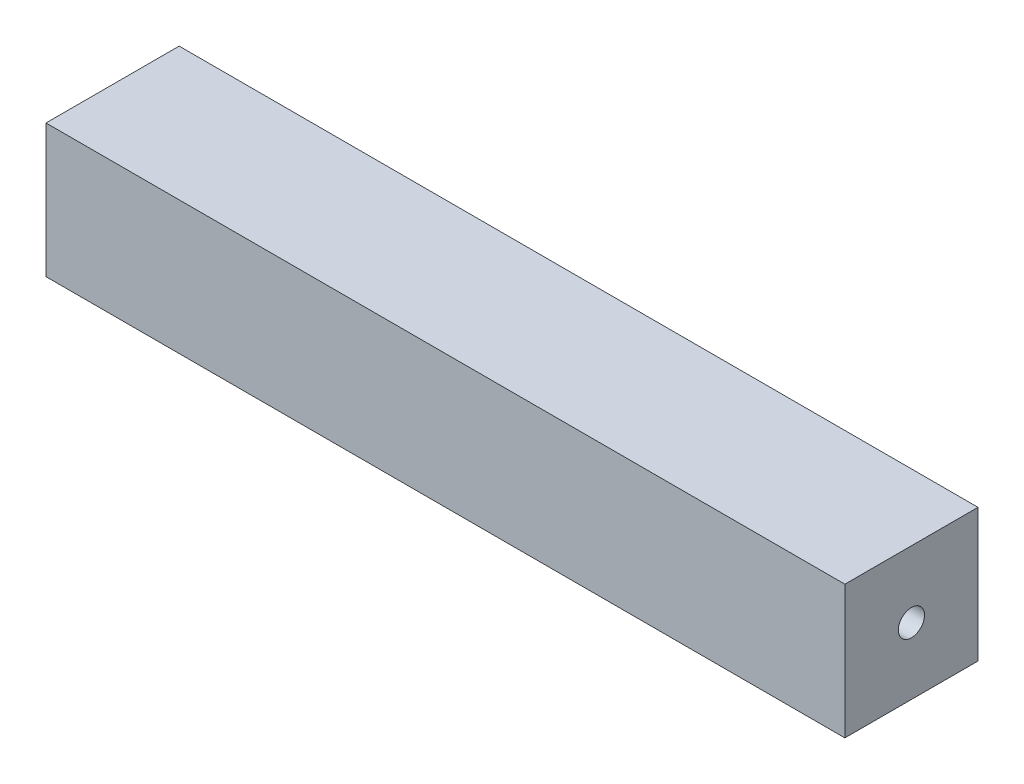
from build123d import *

# Parameters (mm, degrees)
SKETCH1_W           = 76.2
SKETCH1_H           = 12.7
BOSS_EXTRUDE1_DEPTH = 12.7
SKETCH3_R           = 1.25
CUT_EXTRUDE1_DEPTH  = 15.24
CUT_EXTRUDE2_START  = -15.24
SKETCH2_R           = 1.25
CUT_EXTRUDE2_DEPTH  = 15.24


with BuildPart() as part:
    # Sketch1 → Boss-Extrude1 (new body)
    with BuildSketch(Plane(origin=(0, 0, 0), x_dir=(1, 0, 0), z_dir=(0, 1, 0))):
        with Locations((38.1, 6.35)):
            Rectangle(SKETCH1_W, SKETCH1_H)
    extrude(amount=BOSS_EXTRUDE1_DEPTH)

    # Sketch3 → Cut-Extrude1 (cut)
    with BuildSketch(Plane.ZY):
        with Locations((-6.35, 6.35)):
            Circle(SKETCH3_R)
    extrude(amount=-CUT_EXTRUDE1_DEPTH, mode=Mode.SUBTRACT)

    # Sketch2 → Cut-Extrude2 (cut)
    with BuildSketch(Plane(origin=(76.2, 0, 0), x_dir=(0, 0, -1), z_dir=(1, 0, 0)).offset(CUT_EXTRUDE2_START)):
        with Locations(Location((6.35, 6.35, 0), (0, 0, 180))):
            Circle(SKETCH2_R)
    extrude(amount=CUT_EXTRUDE2_DEPTH, mode=Mode.SUBTRACT)


solid = part.part
